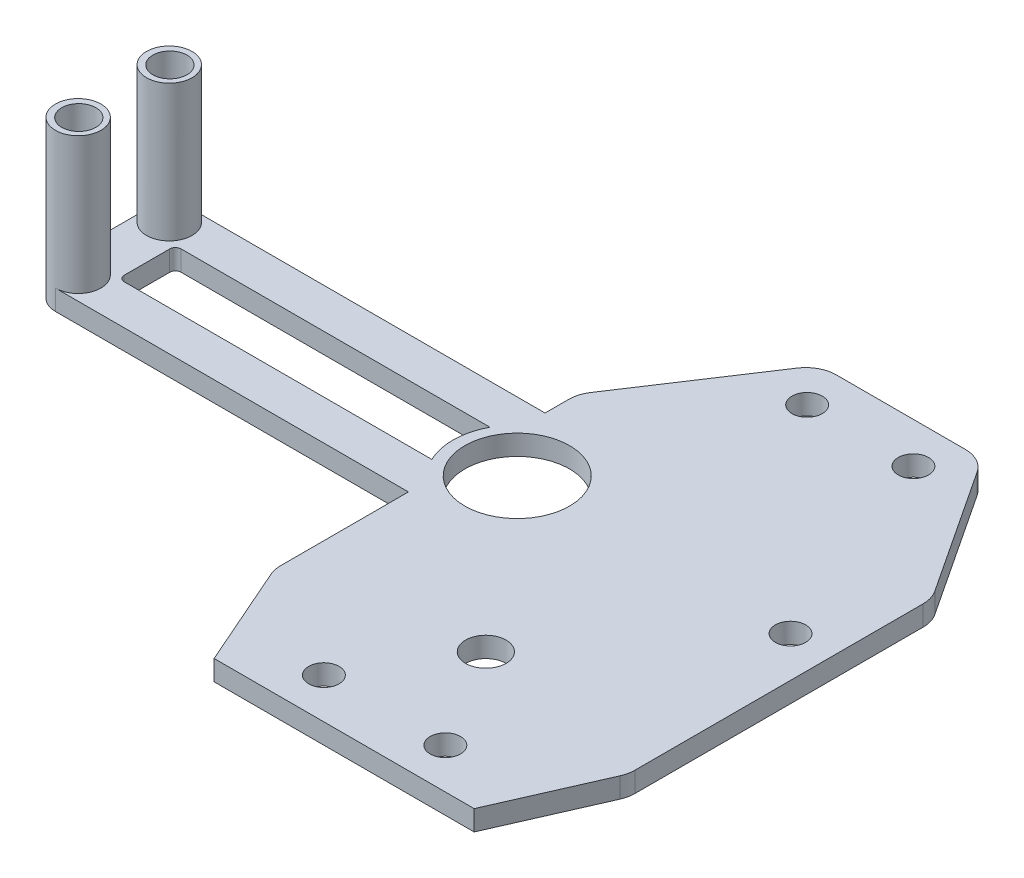
from build123d import *

# Parameters (mm, degrees)
CROQUIS1_R              = 2
CROQUIS1_R_2            = 1.5
SALIENTE_EXTRUIR1_DEPTH = 1
REDONDEO1_R             = 3
SCALE1_SCALE            = 0.888889
SKETCH1_R               = 1.5
BOSS_EXTRUDE1_DEPTH     = 1.777778
BOSS_EXTRUDE2_DEPTH     = 1.777778
SKETCH3_R               = 4.6
CUT_EXTRUDE1_DEPTH      = 10
SKETCH4_R               = 2
SKETCH4_R_2             = 1.5
BOSS_EXTRUDE3_DEPTH     = 12


with BuildPart() as part:
    # Croquis1 → Saliente-Extruir1 (new, symmetric)
    with BuildSketch(Plane(origin=(0, 0, 0), x_dir=(1, 0, 0), z_dir=(0, 1, 0))):
        Polygon((12.846621, 7), (17.5, 17.599716), (17.5, 47.599716), (8, 62), (-8, 62), (-17.5, 47.599716), (-17.5, 17.599716), (-12.846621, 7), align=None)
        with Locations(Location((0, 21, 0), (0, 0, 270))):
            Circle(CROQUIS1_R, mode=Mode.SUBTRACT)
        with Locations(Location((-5.25, 57.994262, 0), (0, 0, 270))):
            Circle(CROQUIS1_R_2, mode=Mode.SUBTRACT)
        with Locations(Location((-13.5, 37.599716, 0), (0, 0, 270))):
            Circle(CROQUIS1_R_2, mode=Mode.SUBTRACT)
        with Locations(Location((13.5, 37.599716, 0), (0, 0, 270))):
            Circle(CROQUIS1_R_2, mode=Mode.SUBTRACT)
        with Locations(Location((5.25, 57.994262, 0), (0, 0, 270))):
            Circle(CROQUIS1_R_2, mode=Mode.SUBTRACT)
        with Locations(Location((-6, 11, 0), (0, 0, 270))):
            Circle(CROQUIS1_R_2, mode=Mode.SUBTRACT)
        with Locations(Location((6, 11, 0), (0, 0, 270))):
            Circle(CROQUIS1_R_2, mode=Mode.SUBTRACT)
    extrude(amount=SALIENTE_EXTRUIR1_DEPTH, both=True)

    # Redondeo1
    redondeo1_edges = [part.edges().sort_by_distance(p)[0] for p in [
        (17.5, 0, -17.599716),
        (-17.5, 0, -17.599716),
        (-17.5, 0, -47.599716),
        (-8, 0, -62),
        (8, 0, -62),
        (17.5, 0, -47.599716),
    ]]
    fillet(redondeo1_edges, radius=REDONDEO1_R)


with BuildPart() as part_1:
    # Scale1: scaled about (0, 0, -33.418377)
    add(part.part.scale(SCALE1_SCALE).moved(Location((0, 0, -3.713153))))

    # Sketch1 → Boss-Extrude1 (add)
    with BuildSketch(Plane.XZ.offset(0.888889)):
        with BuildLine():
            Line((-15.555556, -31.135123), (-46.555556, -31.135123))
            ThreePointArc((-46.555556, -31.135123), (-47.969769, -31.720909), (-48.555556, -33.135123))
            Line((-48.555556, -33.135123), (-48.555556, -41.135123))
            ThreePointArc((-48.555556, -41.135123), (-47.969769, -42.549336), (-46.555556, -43.135123))
            Line((-46.555556, -43.135123), (-15.555556, -43.135123))
            Line((-15.555556, -43.135123), (-15.555556, -39.635123))
            Line((-15.555556, -39.635123), (-44.013891, -39.635123))
            ThreePointArc((-44.013891, -39.635123), (-44.367444, -39.488676), (-44.513891, -39.135123))
            Line((-44.513891, -39.135123), (-44.513891, -35.135123))
            ThreePointArc((-44.513891, -35.135123), (-44.367444, -34.781569), (-44.013891, -34.635123))
            Line((-44.013891, -34.635123), (-15.555556, -34.635123))
            Line((-15.555556, -34.635123), (-15.555556, -31.135123))
        make_face()
        with Locations(Location((-46.5, -33.135123, 0), (0, 0, 270))):
            Circle(SKETCH1_R, mode=Mode.SUBTRACT)
        with Locations(Location((-46.5, -41.135123, 0), (0, 0, 270))):
            Circle(SKETCH1_R, mode=Mode.SUBTRACT)
    extrude(amount=-BOSS_EXTRUDE1_DEPTH)

    # Sketch2 → Boss-Extrude2 (add)
    with BuildSketch(Plane(origin=(0, 0.888889, 0), x_dir=(1, 0, 0), z_dir=(0, 1, 0))):
        with BuildLine():
            Line((-16.898979, 39.635123), (-15.555556, 39.635123))
            Line((-15.555556, 39.635123), (-15.555556, 34.635123))
            Line((-15.555556, 34.635123), (-17.00037, 34.635123))
            ThreePointArc((-17.00037, 34.635123), (-17.545203, 37.147199), (-16.898979, 39.635123))
        make_face()
    extrude(amount=-BOSS_EXTRUDE2_DEPTH)

    # Sketch3 → Cut-Extrude1 (cut)
    with BuildSketch(Plane(origin=(0, 0.888889, 0), x_dir=(1, 0, 0), z_dir=(0, 1, 0))):
        with Locations(Location((-12, 37.135123, 0), (0, 0, 270))):
            Circle(SKETCH3_R)
    extrude(amount=-CUT_EXTRUDE1_DEPTH, mode=Mode.SUBTRACT)

    # Sketch4 → Boss-Extrude3 (add)
    # profile 1 of 2: a face of its own
    with BuildSketch(Plane(origin=(0, 0.888889, 0), x_dir=(1, 0, 0), z_dir=(0, 1, 0))):
        with Locations(Location((-46.555556, 41.135123, 0), (0, 0, 90))):
            Circle(SKETCH4_R)
        with Locations(Location((-46.5, 41.135123, 0), (0, 0, 90))):
            Circle(SKETCH4_R_2, mode=Mode.SUBTRACT)
    # profile 2 of 2: a face of its own
    with BuildSketch(Plane(origin=(0, 0.888889, 0), x_dir=(1, 0, 0), z_dir=(0, 1, 0))):
        with Locations(Location((-46.555556, 33.135123, 0), (0, 0, 270))):
            Circle(SKETCH4_R)
        with Locations(Location((-46.5, 33.135123, 0), (0, 0, 90))):
            Circle(SKETCH4_R_2, mode=Mode.SUBTRACT)
    extrude(amount=BOSS_EXTRUDE3_DEPTH)


solid = part_1.part
